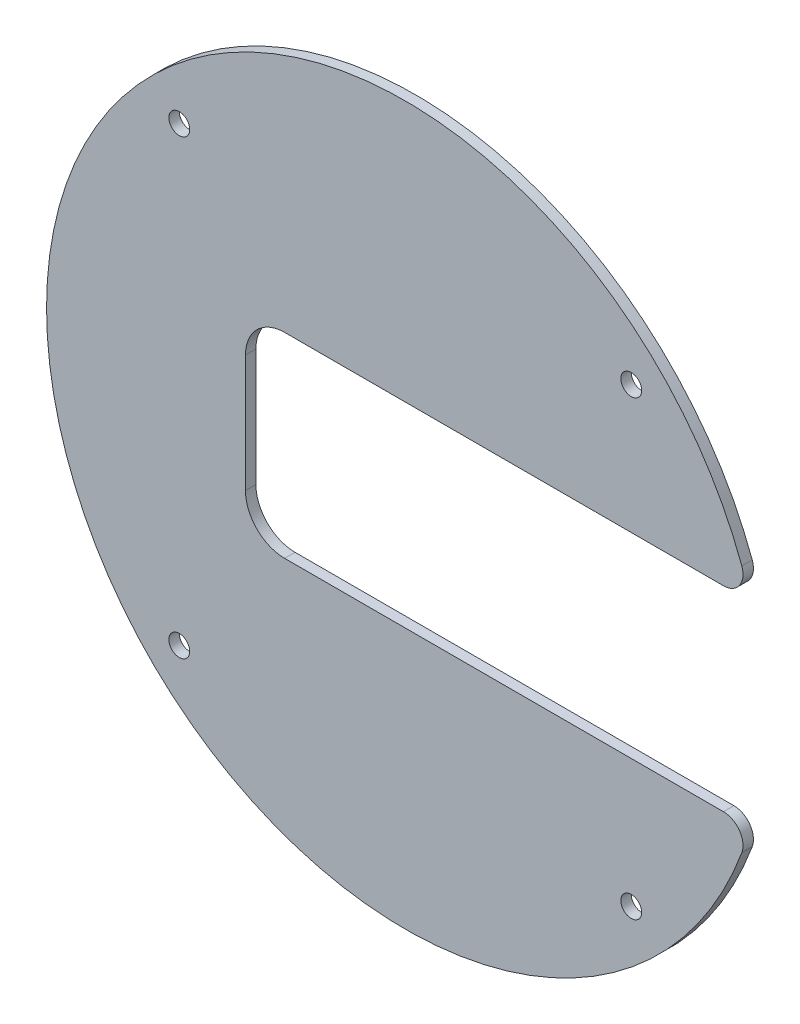
from build123d import *

# Parameters (mm, degrees)
SKETCH_1_R      = 1.6
EXTRUDE_1_DEPTH = 1.6
FILLET_1_R      = 6
FILLET_2_R      = 3


with BuildPart() as part:
    # 草圖1 → 填料-伸長1 (new body)
    with BuildSketch(Plane.XY):
        with BuildLine():
            Line((52.915026221, -15), (-24.5, -15))
            Line((-24.5, -15), (-24.5, 15))
            Line((-24.5, 15), (52.915026221, 15))
            ThreePointArc((52.915026221, 15), (-55, 0), (52.915026221, -15))
        make_face()
        with Locations((34.648232278, 34.648232278)):
            Circle(SKETCH_1_R, mode=Mode.SUBTRACT)
        with Locations((-34.648232278, 34.648232278)):
            Circle(SKETCH_1_R, mode=Mode.SUBTRACT)
        with Locations((-34.648232278, -34.648232278)):
            Circle(SKETCH_1_R, mode=Mode.SUBTRACT)
        with Locations((34.648232278, -34.648232278)):
            Circle(SKETCH_1_R, mode=Mode.SUBTRACT)
    extrude(amount=EXTRUDE_1_DEPTH)

    # 圓角1
    fillet_1_edges = [part.edges().sort_by_distance(p)[0] for p in [
        (-24.5, 15, 0.8),
        (-24.5, -15, 0.8),
    ]]
    fillet(fillet_1_edges, radius=FILLET_1_R)

    # 圓角2
    fillet_2_edges = [part.edges().sort_by_distance(p)[0] for p in [
        (52.915026221, 15, 0.8),
        (52.915026221, -15, 0.8),
    ]]
    fillet(fillet_2_edges, radius=FILLET_2_R)


solid = part.part
